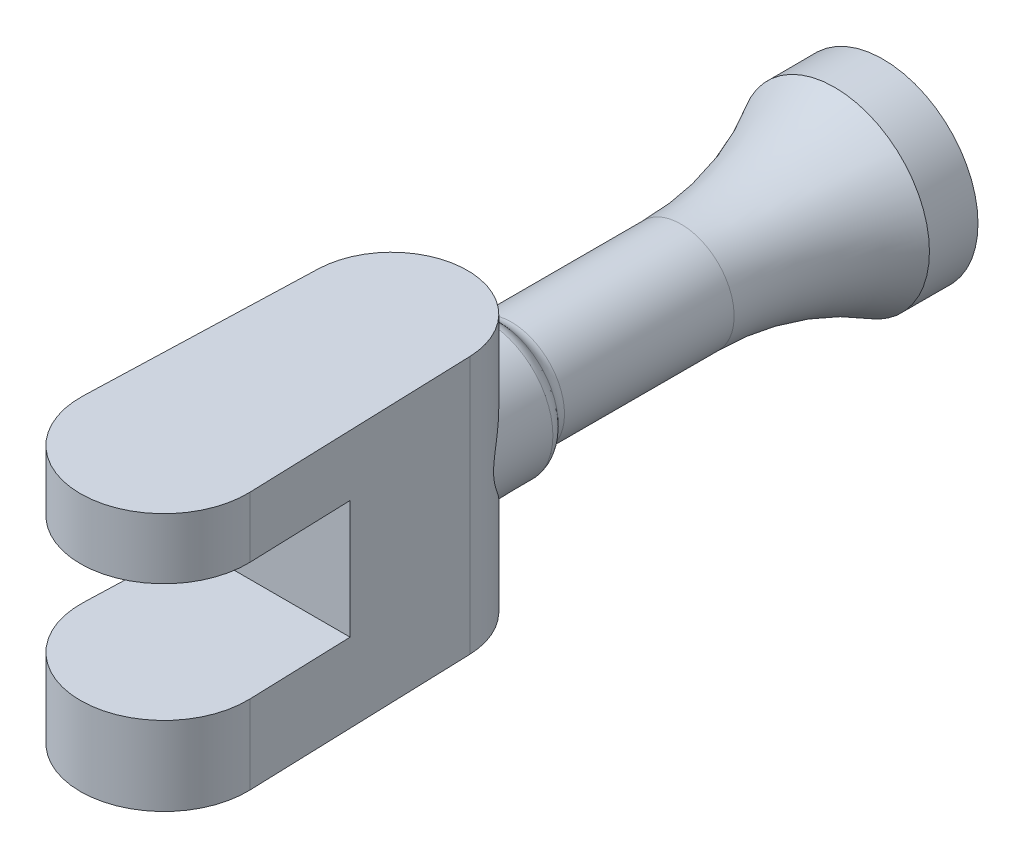
from build123d import *

# Parameters (mm, degrees)
SKETCH_1_R               = 62.5
EXTRUDE_1_DEPTH          = 32
EXTRUDE_2_DEPTH          = 79
EXTRUDE_2_DEPTH_BACK     = 91
CUT_EXTRUDE_1_DEPTH      = 541.396382314
CUT_EXTRUDE_1_DEPTH_BACK = 541.396382314
SKETCH_12_W              = 78
SKETCH_12_H              = 125


with BuildPart() as part:
    # 草圖1 → 填料-伸長1 (new body)
    with BuildSketch(Plane.XY):
        Circle(SKETCH_1_R)
    extrude(amount=EXTRUDE_1_DEPTH)

    # 草圖3 → 旋轉1 (revolve)
    with BuildSketch(Plane(origin=(0, 0, 0), x_dir=(1, 0, 0), z_dir=(0, 1, 0)), mode=Mode.PRIVATE) as revolve_1_sk:
        with BuildLine():
            Line((0, -32), (0, -245))
            Line((0, -245), (35, -245))
            Line((35, -245), (35, -133.211))
            ThreePointArc((35, -133.211), (41.997410306, -80.770756577), (62.5, -32))
            Line((62.5, -32), (0, -32))
        make_face()
    revolve(revolve_1_sk.sketch.rotate(Axis((0, 0, 32), (0, 0, 1)), 180), axis=Axis((0, 0, 32), (0, 0, 1)))

    # 草圖6 → 旋轉2 (revolve)
    with BuildSketch(Plane(origin=(0, 0, 0), x_dir=(1, 0, 0), z_dir=(0, 1, 0))):
        with BuildLine():
            Line((0, -245), (35, -245))
            ThreePointArc((35, -245), (36.015734709, -249.478225638), (38.864145372, -253.08))
            ThreePointArc((38.864145372, -253.08), (41.946904934, -256.68505084), (43.52, -261.16))
            Line((43.52, -261.16), (0, -261.16))
            Line((0, -261.16), (0, -245))
        make_face()
    revolve(axis=Axis((0, 0, 211.16), (0, 0, -1)))

    # 草圖9 → 旋轉3 (revolve)
    with BuildSketch(Plane(origin=(0, 0, 0), x_dir=(1, 0, 0), z_dir=(0, 1, 0)), mode=Mode.PRIVATE) as revolve_3_sk:
        with BuildLine():
            Line((0, -261.16), (0, -322.34))
            Line((0, -322.34), (46.183269827, -322.34))
            ThreePointArc((46.183269827, -322.34), (44.034639015, -291.785565226), (43.52, -261.16))
            Line((43.52, -261.16), (0, -261.16))
        make_face()
    revolve(revolve_3_sk.sketch.rotate(Axis((0, 0, 0), (0, 0, 1)), 180), axis=Axis((0, 0, 0), (0, 0, 1)))

    # 草圖10 → 填料-伸長2 (add, two sides: drawn at the far end of the back side and taken through both)
    with BuildSketch(Plane(origin=(0, 0, 0), x_dir=(0, 0, -1), z_dir=(0, 1, 0)).offset(-EXTRUDE_2_DEPTH_BACK)):
        with BuildLine():
            Line((-322.333333333, 49.972214502), (-472.166666667, 54.969435952))
            ThreePointArc((-472.166666667, 54.969435952), (-529, 0), (-472.166666667, -54.969435952))
            Line((-472.166666667, -54.969435952), (-322.333333333, -49.972214502))
            ThreePointArc((-322.333333333, -49.972214502), (-274, 0), (-322.333333333, 49.972214502))
        make_face()
    extrude(amount=EXTRUDE_2_DEPTH + EXTRUDE_2_DEPTH_BACK)

    # 草圖12 → 除料-伸長1 (cut, two sides: drawn at the far end of the back side and taken through both)
    with BuildSketch(Plane(origin=(0, 0, 0), x_dir=(0, -1, 0), z_dir=(1, 0, 0)).offset(-CUT_EXTRUDE_1_DEPTH_BACK)):
        with Locations((0, -466.5)):
            Rectangle(SKETCH_12_W, SKETCH_12_H)
    extrude(amount=CUT_EXTRUDE_1_DEPTH + CUT_EXTRUDE_1_DEPTH_BACK, mode=Mode.SUBTRACT)


solid = part.part
